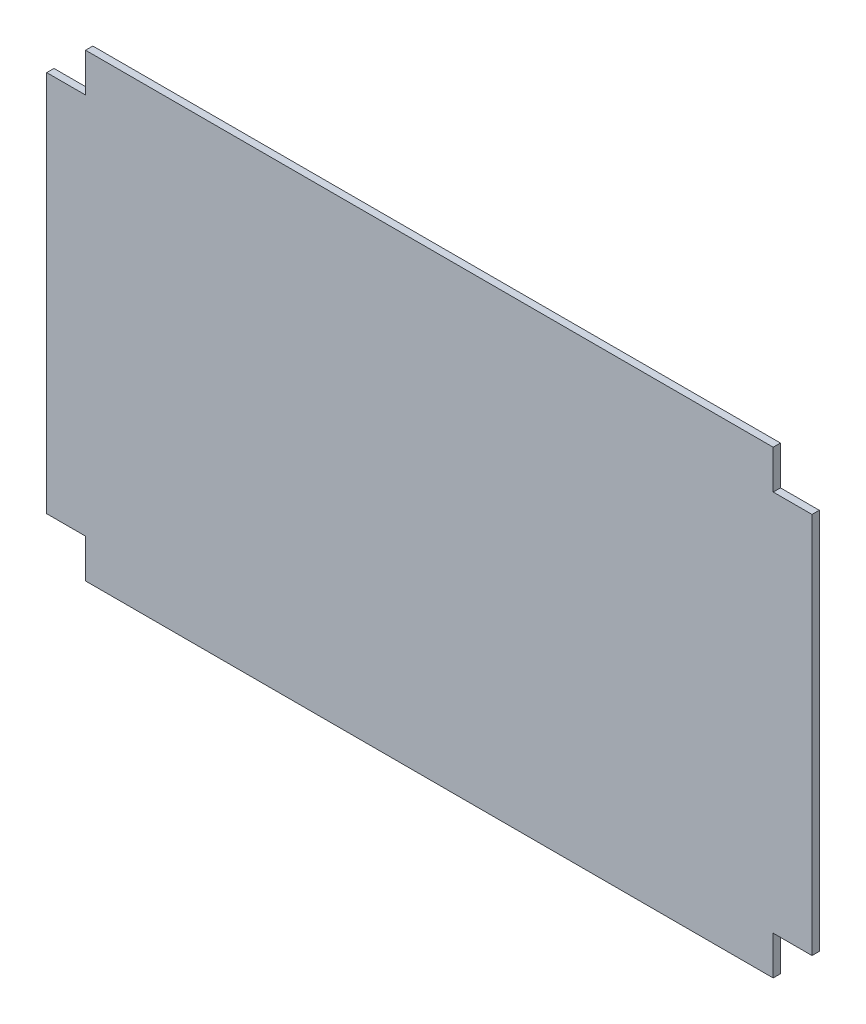
from build123d import *

# Parameters (mm, degrees)
SKETCH_1_W          = 500.8
SKETCH_1_H          = 300.8
EXTRUDE_1_DEPTH     = 4.75
SKETCH_2_W          = 25.4
SKETCH_2_H          = 25.4
CUT_EXTRUDE_1_DEPTH = 10


with BuildPart() as part:
    # 草圖1 → 填料-伸長1 (new body)
    with BuildSketch(Plane.XY):
        Rectangle(SKETCH_1_W, SKETCH_1_H)
    extrude(amount=EXTRUDE_1_DEPTH)

    # 草圖2 → 除料-伸長1 (cut)
    with BuildSketch(Plane(origin=(0, 0, 0), x_dir=(-1, 0, 0), z_dir=(0, 0, -1))):
        with Locations((-237.7, 137.7)):
            Rectangle(SKETCH_2_W, SKETCH_2_H)
        with Locations((-237.7, -137.7)):
            Rectangle(SKETCH_2_W, SKETCH_2_H)
        with Locations((237.7, 137.7)):
            Rectangle(SKETCH_2_W, SKETCH_2_H)
        with Locations((237.7, -137.7)):
            Rectangle(SKETCH_2_W, SKETCH_2_H)
    extrude(amount=-CUT_EXTRUDE_1_DEPTH, mode=Mode.SUBTRACT)


solid = part.part
